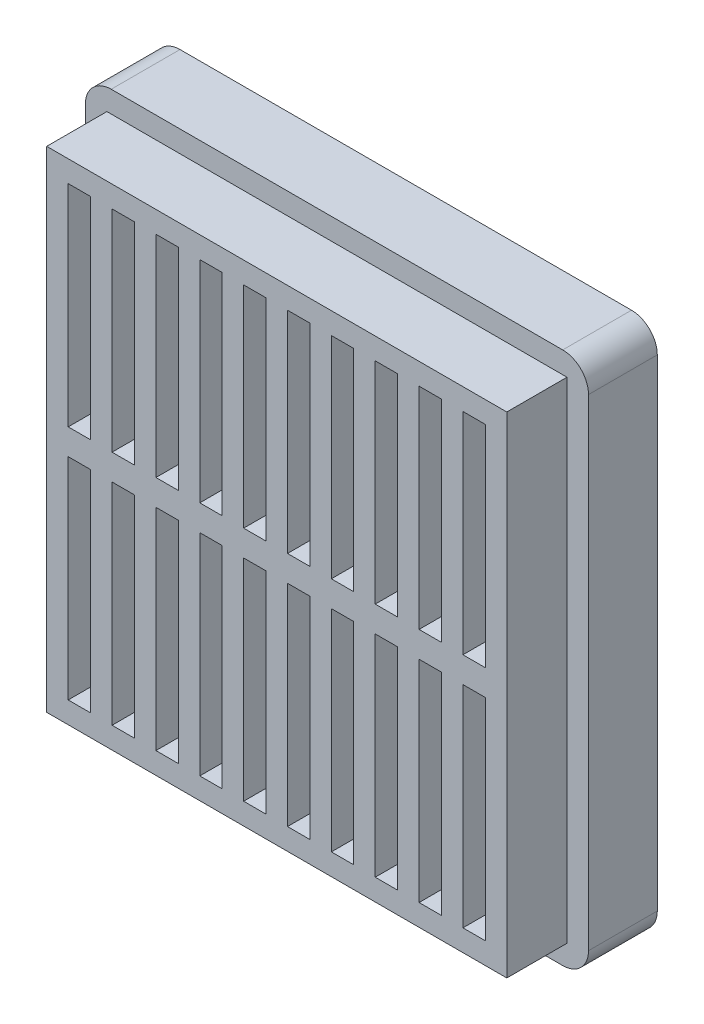
from build123d import *

# Parameters (mm, degrees)
SKETCH_1_W            = 58.5
SKETCH_1_H            = 62
EXTRUDE_1_DEPTH       = 15
SKETCH_2_W            = 58.5
SKETCH_2_H            = 62
SKETCH_2_W_2          = 53.5
SKETCH_2_H_2          = 57
CUT_EXTRUDE_1_DEPTH   = 7
SKETCH_3_W            = 2.6
SKETCH_3_H            = 24.5
CUT_EXTRUDE_1_2_DEPTH = 12
FILLET_1_R            = 3


with BuildPart() as part:
    # Эскиз1 → Бобышка-Вытянуть1 (new body)
    with BuildSketch(Plane.XY):
        Rectangle(SKETCH_1_W, SKETCH_1_H)
    extrude(amount=EXTRUDE_1_DEPTH)

    # Эскиз2 → Cut-Extrude 1 (cut)
    with BuildSketch(Plane.XY.offset(15)):
        Rectangle(SKETCH_2_W, SKETCH_2_H)
        Rectangle(SKETCH_2_W_2, SKETCH_2_H_2, mode=Mode.SUBTRACT)
    extrude(amount=-CUT_EXTRUDE_1_DEPTH, mode=Mode.SUBTRACT)

    # Эскиз3 → Cut-Extrude 1 2 (cut)
    with BuildSketch(Plane.XY.offset(15)):
        with Locations((2.55, 13.75)):
            Rectangle(SKETCH_3_W, SKETCH_3_H)
        with Locations((-2.55, 13.75)):
            Rectangle(SKETCH_3_W, SKETCH_3_H)
        with Locations((7.65, 13.75)):
            Rectangle(SKETCH_3_W, SKETCH_3_H)
        with Locations((12.75, 13.75)):
            Rectangle(SKETCH_3_W, SKETCH_3_H)
        with Locations((17.85, 13.75)):
            Rectangle(SKETCH_3_W, SKETCH_3_H)
        with Locations((22.95, 13.75)):
            Rectangle(SKETCH_3_W, SKETCH_3_H)
        with Locations((-7.65, 13.75)):
            Rectangle(SKETCH_3_W, SKETCH_3_H)
        with Locations((-12.75, 13.75)):
            Rectangle(SKETCH_3_W, SKETCH_3_H)
        with Locations((-17.85, 13.75)):
            Rectangle(SKETCH_3_W, SKETCH_3_H)
        with Locations((-22.95, 13.75)):
            Rectangle(SKETCH_3_W, SKETCH_3_H)
        with Locations((22.95, -13.75)):
            Rectangle(SKETCH_3_W, SKETCH_3_H)
        with Locations((17.85, -13.75)):
            Rectangle(SKETCH_3_W, SKETCH_3_H)
        with Locations((12.75, -13.75)):
            Rectangle(SKETCH_3_W, SKETCH_3_H)
        with Locations((7.65, -13.75)):
            Rectangle(SKETCH_3_W, SKETCH_3_H)
        with Locations((2.55, -13.75)):
            Rectangle(SKETCH_3_W, SKETCH_3_H)
        with Locations((-2.55, -13.75)):
            Rectangle(SKETCH_3_W, SKETCH_3_H)
        with Locations((-7.65, -13.75)):
            Rectangle(SKETCH_3_W, SKETCH_3_H)
        with Locations((-12.75, -13.75)):
            Rectangle(SKETCH_3_W, SKETCH_3_H)
        with Locations((-17.85, -13.75)):
            Rectangle(SKETCH_3_W, SKETCH_3_H)
        with Locations((-22.95, -13.75)):
            Rectangle(SKETCH_3_W, SKETCH_3_H)
    extrude(amount=-CUT_EXTRUDE_1_2_DEPTH, mode=Mode.SUBTRACT)

    # Скругление1
    fillet_1_edges = [part.edges().sort_by_distance(p)[0] for p in [
        (29.25, -31, 4),
        (-29.25, -31, 4),
        (-29.25, 31, 4),
        (29.25, 31, 4),
    ]]
    fillet(fillet_1_edges, radius=FILLET_1_R)


solid = part.part
